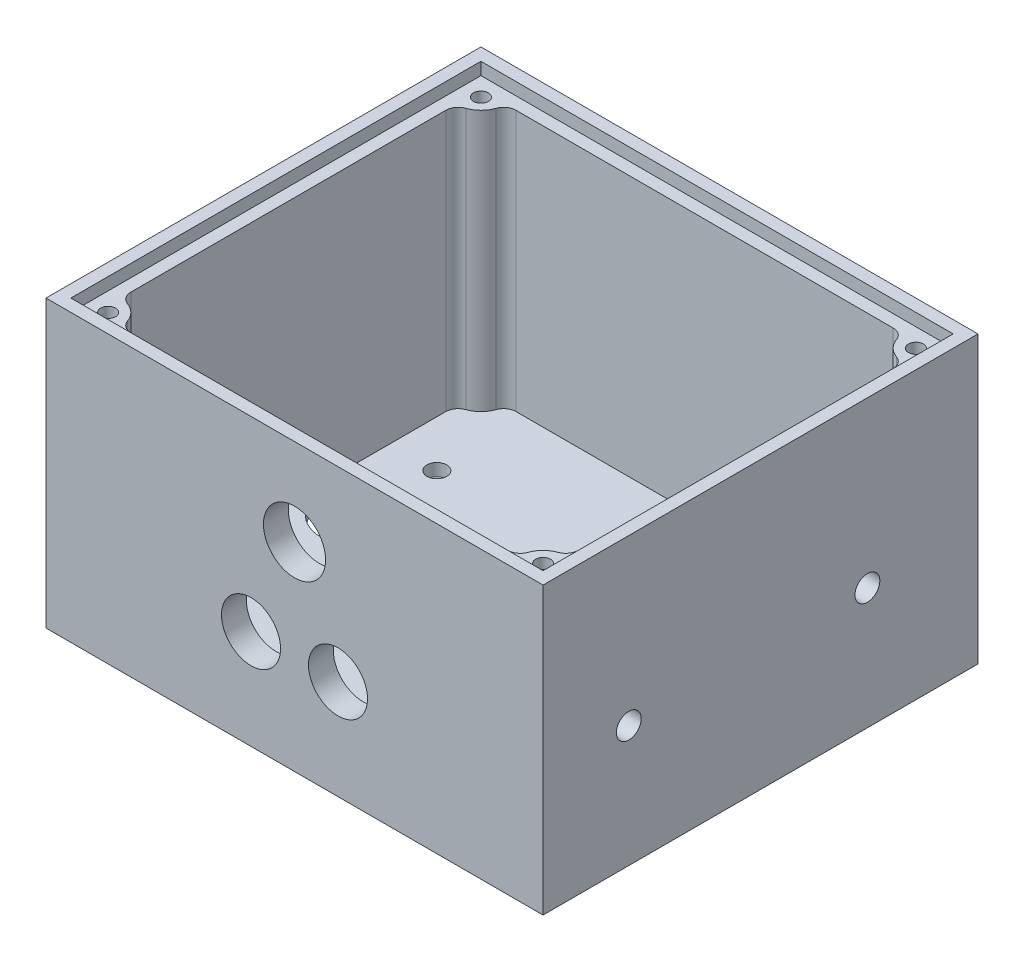
from build123d import *

# Parameters (mm, degrees)
SKETCH1_W           = 101.6
SKETCH1_H           = 88.9
BOSS_EXTRUDE1_DEPTH = 58.42
SKETCH2_W           = 91.44
SKETCH2_H           = 78.74
CUT_EXTRUDE1_DEPTH  = 55.88
SKETCH3_R           = 7.874
SKETCH3_R_2         = 2.032
CUT_EXTRUDE2_DEPTH  = 147.110726506
CUT_EXTRUDE3_DEPTH  = 147.110726506
SKETCH6_R           = 2.54
CUT_EXTRUDE4_DEPTH  = 144.639189638
SKETCH8_R           = 6.0325
CUT_EXTRUDE5_DEPTH  = 145.087642773
SKETCH9_W           = 96.52
SKETCH9_H           = 83.82
CUT_EXTRUDE6_DEPTH  = 2.54
SKETCH10_R          = 6.35
CUT_EXTRUDE7_DEPTH  = 145.087642773
BOSS_EXTRUDE2_DEPTH = 53.34
FILLET1_R           = 2.54
SKETCH13_R          = 1.524
CUT_EXTRUDE8_DEPTH  = 12.7


with BuildPart() as part:
    # Sketch1 → Boss-Extrude1 (new body)
    with BuildSketch(Plane(origin=(0, 0, 0), x_dir=(1, 0, 0), z_dir=(0, 1, 0))):
        with Locations((50.8, 44.45)):
            Rectangle(SKETCH1_W, SKETCH1_H)
    extrude(amount=BOSS_EXTRUDE1_DEPTH)

    # Sketch2 → Cut-Extrude1 (cut)
    with BuildSketch(Plane(origin=(0, 58.42, 0), x_dir=(1, 0, 0), z_dir=(0, 1, 0))):
        with Locations((50.8, 44.45)):
            Rectangle(SKETCH2_W, SKETCH2_H)
    extrude(amount=-CUT_EXTRUDE1_DEPTH, mode=Mode.SUBTRACT)

    # Sketch3 → Cut-Extrude2 (cut, through all)
    with BuildSketch(Plane(origin=(0, 2.54, 0), x_dir=(1, 0, 0), z_dir=(0, 1, 0))):
        with Locations(Location((14.605, 49.53, 0), (0, 0, 270))):
            Circle(SKETCH3_R)
        with Locations(Location((14.605, 65.278, 0), (0, 0, 270))):
            Circle(SKETCH3_R_2)
        with Locations(Location((14.605, 23.368, 0), (0, 0, 270))):
            Circle(SKETCH3_R_2)
    extrude(amount=-CUT_EXTRUDE2_DEPTH, mode=Mode.SUBTRACT)

    # Sketch5 → Cut-Extrude3 (cut, through all)
    with BuildSketch(Plane(origin=(0, 2.54, 0), x_dir=(1, 0, 0), z_dir=(0, 1, 0))):
        with BuildLine():
            ThreePointArc((49.279390438, 55.7784), (50.8, 33.02), (52.320609562, 55.7784))
            ThreePointArc((52.320609562, 55.7784), (50.8, 57.404), (49.279390438, 55.7784))
        make_face()
    extrude(amount=-CUT_EXTRUDE3_DEPTH, mode=Mode.SUBTRACT)

    # Sketch6 → Cut-Extrude4 (cut, through all)
    with BuildSketch(Plane.ZY.offset(-96.52)):
        with Locations((-17.526, 24.765)):
            Circle(SKETCH6_R)
        with Locations((-66.294, 24.765)):
            Circle(SKETCH6_R)
    extrude(amount=-CUT_EXTRUDE4_DEPTH, mode=Mode.SUBTRACT)

    # Sketch8 → Cut-Extrude5 (cut, through all)
    with BuildSketch(Plane(origin=(0, 0, -5.08), x_dir=(-1, 0, 0), z_dir=(0, 0, -1))):
        with Locations((-41.91, 20.32)):
            Circle(SKETCH8_R)
        with Locations((-59.69, 20.32)):
            Circle(SKETCH8_R)
    extrude(amount=-CUT_EXTRUDE5_DEPTH, mode=Mode.SUBTRACT)

    # Sketch9 → Cut-Extrude6 (cut)
    with BuildSketch(Plane(origin=(0, 58.42, 0), x_dir=(1, 0, 0), z_dir=(0, 1, 0))):
        with Locations((50.8, 44.45)):
            Rectangle(SKETCH9_W, SKETCH9_H)
    extrude(amount=-CUT_EXTRUDE6_DEPTH, mode=Mode.SUBTRACT)

    # Sketch10 → Cut-Extrude7 (cut, through all)
    with BuildSketch(Plane(origin=(0, 0, -5.08), x_dir=(-1, 0, 0), z_dir=(0, 0, -1))):
        with Locations((-50.8, 40.64)):
            Circle(SKETCH10_R)
    extrude(amount=-CUT_EXTRUDE7_DEPTH, mode=Mode.SUBTRACT)

    # Sketch11 → Boss-Extrude2 (add)
    with BuildSketch(Plane(origin=(0, 2.54, 0), x_dir=(1, 0, 0), z_dir=(0, 1, 0))):
        with BuildLine():
            Line((10.16, 83.82), (5.08, 83.82))
            Line((5.08, 83.82), (5.08, 78.74))
            ThreePointArc((5.08, 78.74), (8.672102448, 80.227897552), (10.16, 83.82))
        make_face()
        with BuildLine():
            Line((5.08, 10.16), (5.08, 5.08))
            Line((5.08, 5.08), (10.16, 5.08))
            ThreePointArc((10.16, 5.08), (8.672102448, 8.672102448), (5.08, 10.16))
        make_face()
        with BuildLine():
            Line((96.52, 10.16), (96.52, 5.08))
            Line((96.52, 5.08), (91.44, 5.08))
            ThreePointArc((91.44, 5.08), (92.927897552, 8.672102448), (96.52, 10.16))
        make_face()
        with BuildLine():
            Line((96.52, 78.74), (96.52, 83.82))
            Line((96.52, 83.82), (91.44, 83.82))
            ThreePointArc((91.44, 83.82), (92.927897552, 80.227897552), (96.52, 78.74))
        make_face()
    extrude(amount=BOSS_EXTRUDE2_DEPTH)

    # Fillet1
    fillet1_edges = [part.edges().sort_by_distance(p)[0] for p in [
        (91.44, 29.21, -5.08),
        (96.52, 29.21, -10.16),
        (91.44, 29.21, -83.82),
        (96.52, 29.21, -78.74),
        (5.08, 29.21, -78.74),
        (10.16, 29.21, -83.82),
        (10.16, 29.21, -5.08),
        (5.08, 29.21, -10.16),
    ]]
    fillet(fillet1_edges, radius=FILLET1_R)

    # Sketch13 → Cut-Extrude8 (cut)
    with BuildSketch(Plane(origin=(0, 55.88, 0), x_dir=(1, 0, 0), z_dir=(0, 1, 0))):
        with Locations(Location((6.35, 82.55, 0), (0, 0, 270))):
            Circle(SKETCH13_R)
        with Locations(Location((95.25, 82.55, 0), (0, 0, 270))):
            Circle(SKETCH13_R)
        with Locations(Location((95.25, 6.35, 0), (0, 0, 270))):
            Circle(SKETCH13_R)
        with Locations(Location((6.35, 6.35, 0), (0, 0, 270))):
            Circle(SKETCH13_R)
    extrude(amount=-CUT_EXTRUDE8_DEPTH, mode=Mode.SUBTRACT)


solid = part.part
